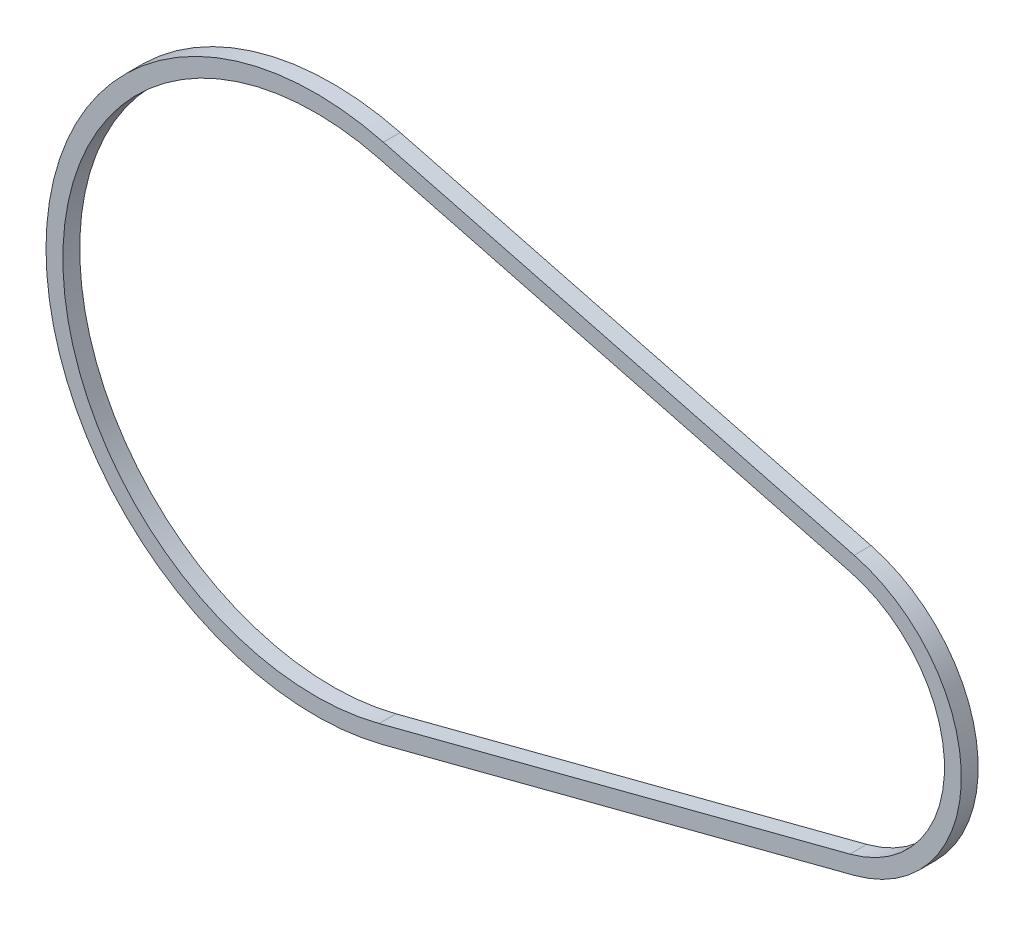
from build123d import *

# Parameters (mm, degrees)
BOSS_EXTRUDE1_DEPTH = 10


with BuildPart() as part:
    # Sketch1 → Boss-Extrude1 (new body)
    with BuildSketch(Plane.XY):
        with BuildLine():
            Line((40.236051502, 154.858193711), (319.615402361, 82.268415409))
            ThreePointArc((319.615402361, 82.268415409), (383.24, 0), (319.615402361, -82.268415409))
            Line((319.615402361, -82.268415409), (40.236051502, -154.858193711))
            ThreePointArc((40.236051502, -154.858193711), (-160, 0), (40.236051502, 154.858193711))
        make_face()
        with BuildLine():
            Line((37.721298283, 145.179556604), (317.100649142, 72.589778302))
            ThreePointArc((317.100649142, 72.589778302), (373.24, 0), (317.100649142, -72.589778302))
            Line((317.100649142, -72.589778302), (37.721298283, -145.179556604))
            ThreePointArc((37.721298283, -145.179556604), (-150, 0), (37.721298283, 145.179556604))
        make_face(mode=Mode.SUBTRACT)
    extrude(amount=BOSS_EXTRUDE1_DEPTH)


solid = part.part
